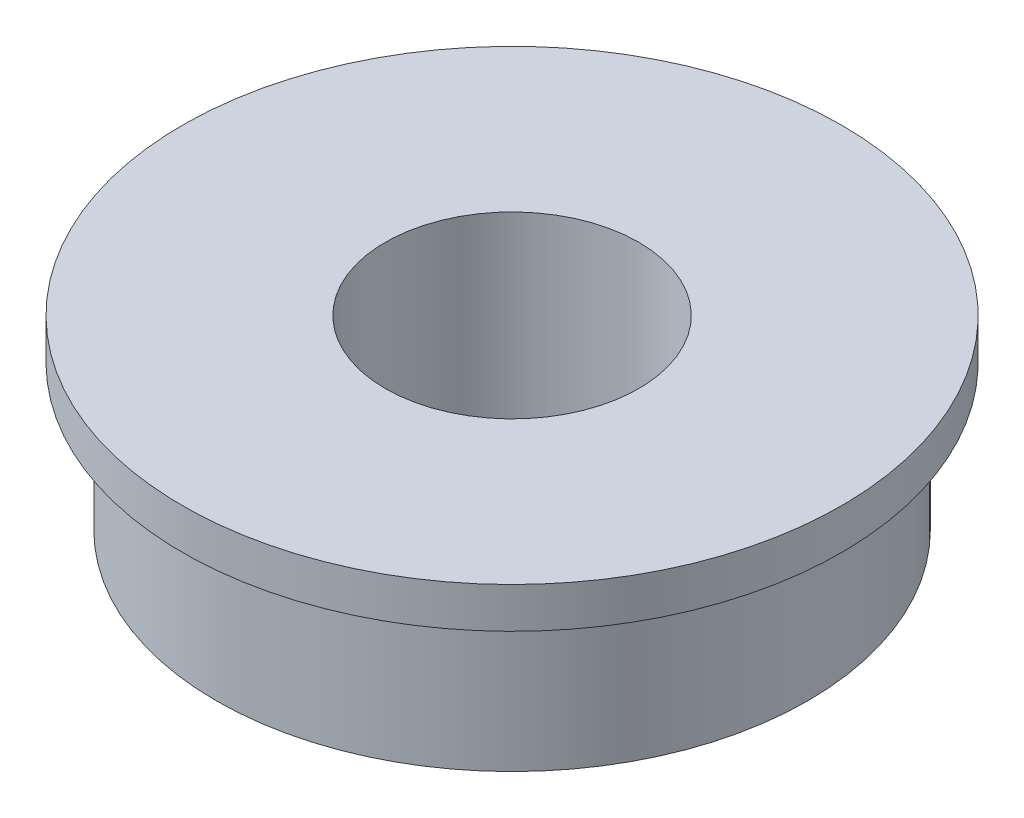
from build123d import *

# Parameters (mm, degrees)
SKETCH1_R           = 11.1125
BOSS_EXTRUDE1_DEPTH = 5.461
SKETCH2_R           = 12.3825
BOSS_EXTRUDE2_DEPTH = 1.524
SKETCH3_R           = 4.7625
CUT_EXTRUDE1_DEPTH  = 16.764


with BuildPart() as part:
    # Sketch1 → Boss-Extrude1 (new body)
    with BuildSketch(Plane(origin=(0, 0, 0), x_dir=(1, 0, 0), z_dir=(0, 1, 0))):
        with Locations(Location((-11.588638049, 0, 0), (0, 0, 270))):
            Circle(SKETCH1_R)
    extrude(amount=BOSS_EXTRUDE1_DEPTH)

    # Sketch2 → Boss-Extrude2 (add)
    with BuildSketch(Plane(origin=(0, 5.461, 0), x_dir=(1, 0, 0), z_dir=(0, 1, 0))):
        with Locations(Location((-11.588638049, 0, 0), (0, 0, 90))):
            Circle(SKETCH2_R)
    extrude(amount=BOSS_EXTRUDE2_DEPTH)

    # Sketch3 → Cut-Extrude1 (cut)
    with BuildSketch(Plane(origin=(0, 6.985, 0), x_dir=(1, 0, 0), z_dir=(0, 1, 0))):
        with Locations(Location((-11.588638049, 0, 0), (0, 0, 270))):
            Circle(SKETCH3_R)
    extrude(amount=-CUT_EXTRUDE1_DEPTH, mode=Mode.SUBTRACT)


solid = part.part
